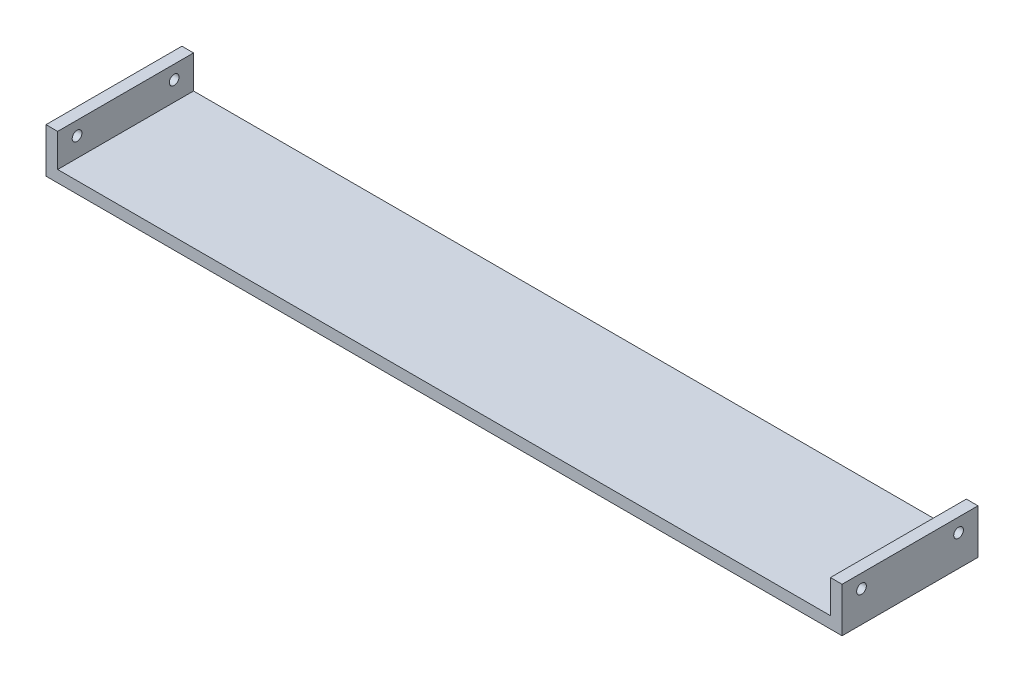
from build123d import *

# Parameters (mm, degrees)
SKETCH1_W           = 410
SKETCH1_H           = 70
BOSS_EXTRUDE1_DEPTH = 6
SKETCH2_W           = 6
SKETCH2_H           = 70
BOSS_EXTRUDE2_DEPTH = 25
SKETCH3_R           = 2.5
CUT_EXTRUDE1_DEPTH  = 418.891673384
SKETCH4_W           = 70
SKETCH4_H           = 8
CUT_EXTRUDE2_DEPTH  = 418.891673384


with BuildPart() as part:
    # Sketch1 → Boss-Extrude1 (new body)
    with BuildSketch(Plane(origin=(0, 0, 0), x_dir=(1, 0, 0), z_dir=(0, 1, 0))):
        with Locations((134.639039491, 39.648849176)):
            Rectangle(SKETCH1_W, SKETCH1_H)
    extrude(amount=BOSS_EXTRUDE1_DEPTH)

    # Sketch2 → Boss-Extrude2 (add)
    with BuildSketch(Plane(origin=(0, 6, 0), x_dir=(1, 0, 0), z_dir=(0, 1, 0))):
        with Locations((-67.360960509, 39.648849176)):
            Rectangle(SKETCH2_W, SKETCH2_H)
        with Locations((336.639039491, 39.648849176)):
            Rectangle(SKETCH2_W, SKETCH2_H)
    extrude(amount=BOSS_EXTRUDE2_DEPTH)

    # Sketch3 → Cut-Extrude1 (cut, through all)
    with BuildSketch(Plane.ZY.offset(70.360960509)):
        with Locations((-64.648849176, 16)):
            Circle(SKETCH3_R)
        with Locations((-14.648849176, 16)):
            Circle(SKETCH3_R)
    extrude(amount=-CUT_EXTRUDE1_DEPTH, mode=Mode.SUBTRACT)

    # Sketch4 → Cut-Extrude2 (cut, through all)
    with BuildSketch(Plane(origin=(339.639039491, 0, 0), x_dir=(0, 0, -1), z_dir=(1, 0, 0))):
        with Locations((39.648849176, 27)):
            Rectangle(SKETCH4_W, SKETCH4_H)
    extrude(amount=-CUT_EXTRUDE2_DEPTH, mode=Mode.SUBTRACT)


solid = part.part
